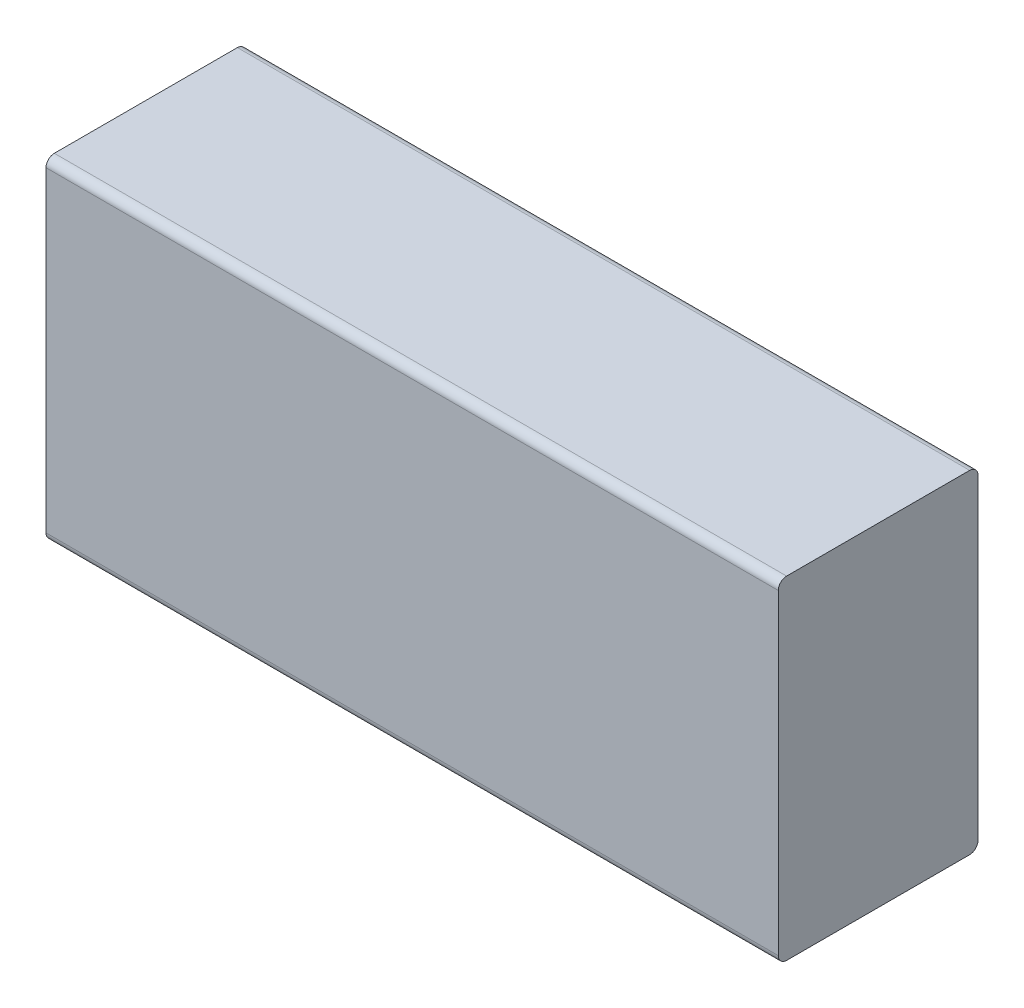
from build123d import *

# Parameters (mm, degrees)
EXTRUDE1_DEPTH = 6
SKETCH2_W      = 22
SKETCH2_H      = 10
EXTRUDE2_DEPTH = 6
FILLET1_R      = 0.25


with BuildPart() as part:
    # Sketch1 → Extrude1 (new body)
    with BuildSketch(Plane.XY):
        with BuildLine():
            Line((0, 5), (-17, 5))
            Line((-17, 5), (-17, -5))
            Line((-17, -5), (0, -5))
            ThreePointArc((0, -5), (5, 0), (0, 5))
        make_face()
    extrude(amount=EXTRUDE1_DEPTH)

    # Sketch2 → Extrude2 (add)
    with BuildSketch(Plane.XY):
        with Locations((-6, 0)):
            Rectangle(SKETCH2_W, SKETCH2_H)
    extrude(amount=EXTRUDE2_DEPTH)

    # Fillet1
    fillet1_edges = [part.edges().sort_by_distance(p)[0] for p in [
        (-6, -5, 6),
        (-6, -5, 0),
        (-6, 5, 0),
        (-6, 5, 6),
    ]]
    fillet(fillet1_edges, radius=FILLET1_R)


solid = part.part
